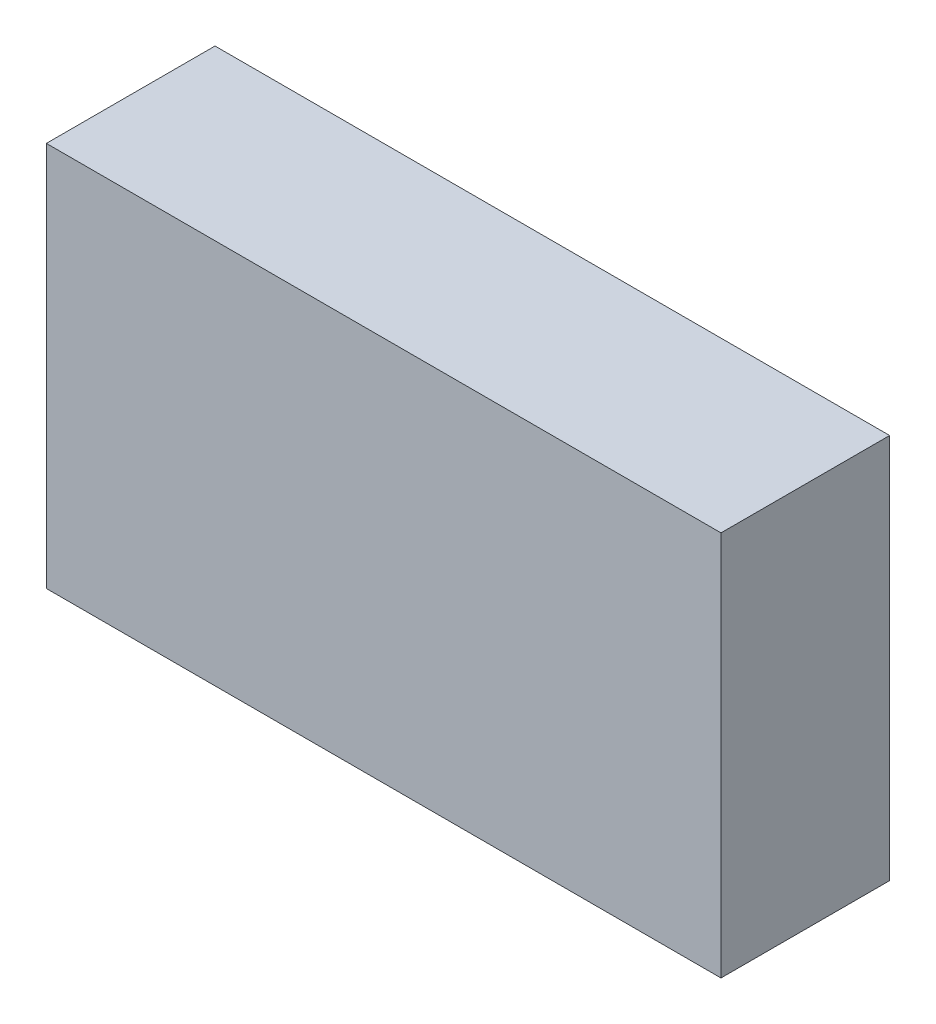
from build123d import *

# Parameters (mm, degrees)
SKETCH2_W           = 177.8
SKETCH2_H           = 44.45
BOSS_EXTRUDE1_DEPTH = 101.6


with BuildPart() as part:
    # Sketch2 → Boss-Extrude1 (new body)
    with BuildSketch(Plane(origin=(0, 0, 0), x_dir=(1, 0, 0), z_dir=(0, 1, 0))):
        with Locations((0, -22.225)):
            Rectangle(SKETCH2_W, SKETCH2_H)
    extrude(amount=-BOSS_EXTRUDE1_DEPTH)


solid = part.part
